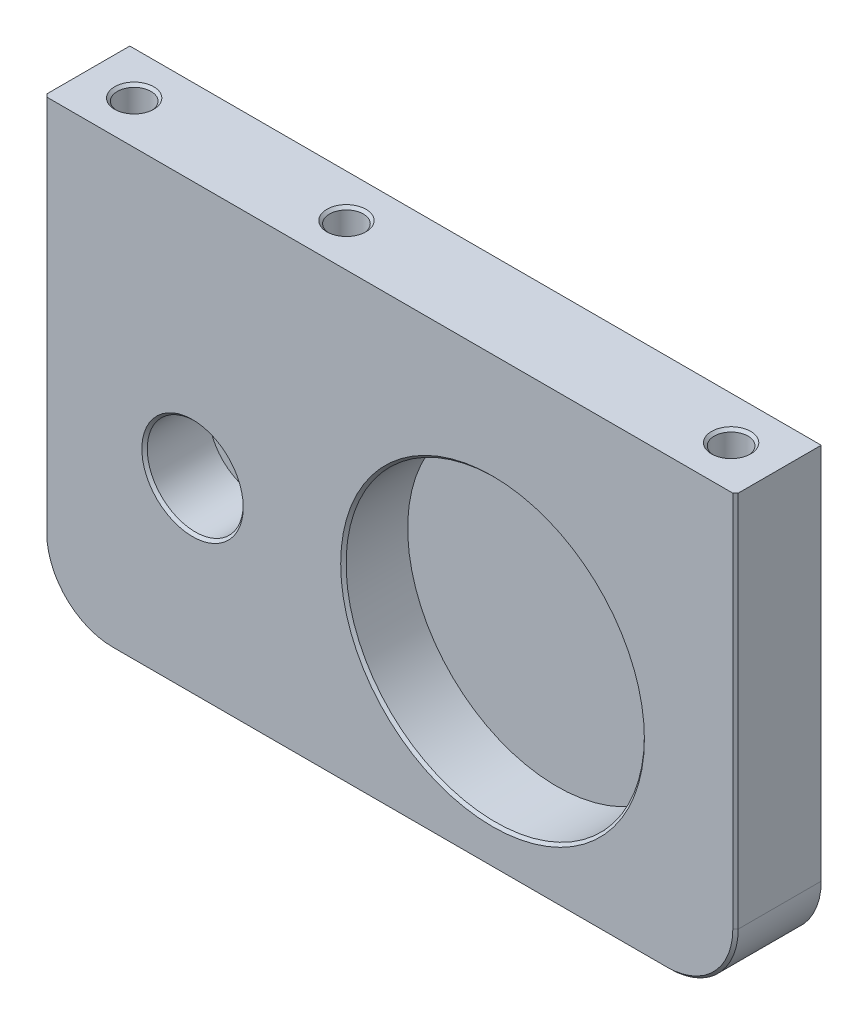
from build123d import *

# Parameters (mm, degrees)
SKETCH1_W           = 51.225
SKETCH1_H           = 33.05
BOSS_EXTRUDE1_DEPTH = 6.35
SKETCH7_R           = 11.05
SKETCH7_R_2         = 3.556
CUT_EXTRUDE3_DEPTH  = 4.7625
SKETCH8_R           = 1.25
CUT_EXTRUDE4_DEPTH  = 15
FILLET3_R           = 5.08
CHAMFER2_SIZE       = 0.2


with BuildPart() as part:
    # Sketch1 → Boss-Extrude1 (new body)
    with BuildSketch(Plane.XY.offset(152.111703917)):
        with Locations((-7.6125, 2.525)):
            Rectangle(SKETCH1_W, SKETCH1_H)
    extrude(amount=-BOSS_EXTRUDE1_DEPTH)

    # Sketch7 → Cut-Extrude3 (cut)
    with BuildSketch(Plane.XY.offset(152.111703917)):
        Circle(SKETCH7_R)
        with Locations((-22.225, 0)):
            Circle(SKETCH7_R_2)
    extrude(amount=-CUT_EXTRUDE3_DEPTH, mode=Mode.SUBTRACT)

    # Sketch8 → Cut-Extrude4 (cut)
    with BuildSketch(Plane(origin=(0, 19.05, 0), x_dir=(1, 0, 0), z_dir=(0, 1, 0))):
        with Locations(Location((-29.725, -148.936703917, 0), (0, 0, 270))):
            Circle(SKETCH8_R)
        with Locations(Location((-14, -148.936703917, 0), (0, 0, 270))):
            Circle(SKETCH8_R)
        with Locations(Location((14.5, -148.936703917, 0), (0, 0, 270))):
            Circle(SKETCH8_R)
    extrude(amount=-CUT_EXTRUDE4_DEPTH, mode=Mode.SUBTRACT)

    # Fillet3
    fillet3_edges = [part.edges().sort_by_distance(p)[0] for p in [
        (18, -14, 148.936703917),
        (-33.225, -14, 148.936703917),
    ]]
    fillet(fillet3_edges, radius=FILLET3_R)

    # Chamfer2
    chamfer2_edges = [part.edges().sort_by_distance(p)[0] for p in [
        (-11.05, 0, 152.111703917),
        (-25.781, 0, 152.111703917),
        (-29.725, 19.05, 147.686703917),
        (-14, 19.05, 147.686703917),
        (14.5, 19.05, 147.686703917),
        (-7.6125, -14, 152.111703917),
        (18, 5.065, 152.111703917),
        (-31.737102448, -12.512102448, 152.111703917),
        (16.512102448, -12.512102448, 152.111703917),
        (-33.225, 5.065, 152.111703917),
    ]]
    chamfer(chamfer2_edges, length=CHAMFER2_SIZE)


solid = part.part
